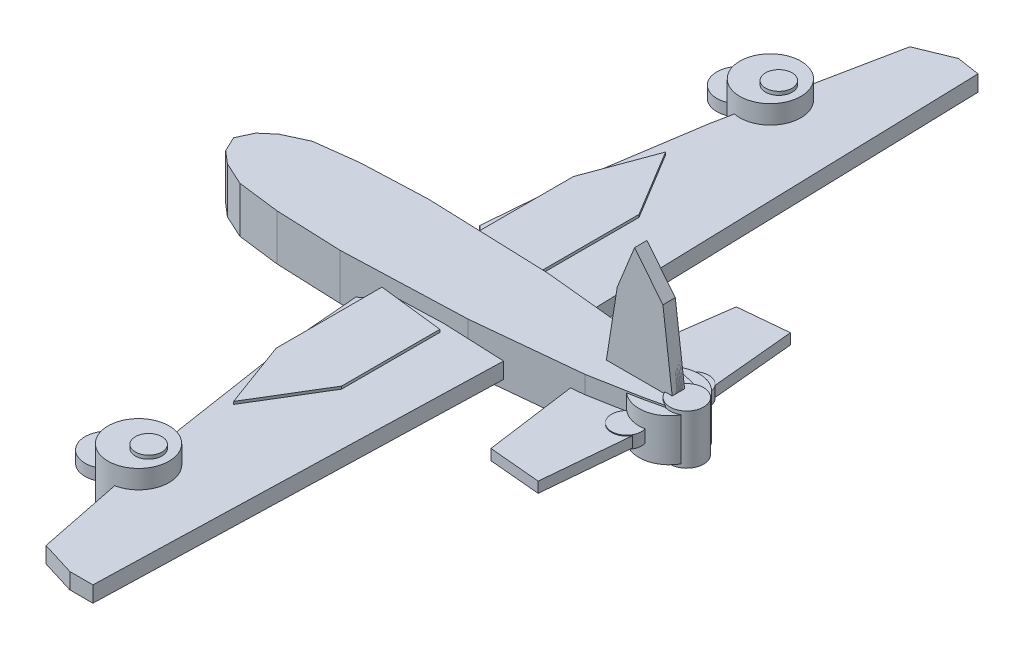
from build123d import *

# Parameters (mm, degrees)
BOSS_EXTRUDE1_DEPTH  = 130
BOSS_EXTRUDE2_DEPTH  = 57.5
SKETCH3_R            = 125
BOSS_EXTRUDE3_DEPTH  = 72.5
BOSS_EXTRUDE4_DEPTH  = 45
BOSS_EXTRUDE5_DEPTH  = 45
BOSS_EXTRUDE6_DEPTH  = 60
BOSS_EXTRUDE7_DEPTH  = 22.5
BOSS_EXTRUDE8_DEPTH  = 60
BOSS_EXTRUDE9_DEPTH  = 22.5
BOSS_EXTRUDE10_DEPTH = 30
BOSS_EXTRUDE11_DEPTH = 30
BOSS_EXTRUDE12_DEPTH = 35
BOSS_EXTRUDE13_DEPTH = 27.5
SKETCH14_R           = 172.485593128
BOSS_EXTRUDE14_DEPTH = 150
SKETCH15_R           = 172.485593128
BOSS_EXTRUDE15_DEPTH = 150
SKETCH16_R           = 170
BOSS_EXTRUDE16_DEPTH = 120
SKETCH17_R           = 75
BOSS_EXTRUDE17_DEPTH = 170
SKETCH18_R           = 75
BOSS_EXTRUDE18_DEPTH = 170
SKETCH19_R           = 95
BOSS_EXTRUDE19_DEPTH = 140
SKETCH20_R           = 129.971186256
BOSS_EXTRUDE20_DEPTH = 32.5
SKETCH21_R           = 85
BOSS_EXTRUDE21_DEPTH = 35
SKETCH22_R           = 129.971186256
BOSS_EXTRUDE22_DEPTH = 32.5
SKETCH23_R           = 85
BOSS_EXTRUDE23_DEPTH = 35
SKETCH24_R           = 125
BOSS_EXTRUDE24_DEPTH = 45
SKETCH25_R           = 75
BOSS_EXTRUDE25_DEPTH = 55


with BuildPart() as part:
    # Sketch1 → Boss-Extrude1 (new, symmetric)
    with BuildSketch(Plane(origin=(0, 0, 0), x_dir=(1, 0, 0), z_dir=(0, 1, 0))):
        Polygon((-1300, 0), (-1260, 85), (-1190, 145), (-1060, 205), (-820, 235), (-450, 250), (250, 225), (850, 165), (1120, 115), (1250, 85), (1300, 0), (1250, -85), (1120, -115), (850, -165), (250, -225), (-450, -250), (-820, -235), (-1060, -205), (-1190, -145), (-1260, -85), align=None)
    extrude(amount=BOSS_EXTRUDE1_DEPTH, both=True)


with BuildPart() as body_2:
    # Sketch2 → Boss-Extrude2 (new, symmetric)
    with BuildSketch(Plane(origin=(0, 0, 0), x_dir=(1, 0, 0), z_dir=(0, 1, 0))):
        Polygon((400, 25), (400, 70.922011884), (362.961005942, 107.961005942), (330.489239933, 140.432771951), (280, 140.432771951), (-560, 140.432771951), (-605.922011884, 140.432771951), (-638.393777893, 107.961005942), (-675.432771951, 70.922011884), (-675.432771951, 25), (-675.432771951, -25), (-675.432771951, -70.922011884), (-638.393777893, -107.961005942), (-605.922011884, -140.432771951), (-560, -140.432771951), (280, -140.432771951), (330.489239933, -140.432771951), (362.961005942, -107.961005942), (400, -70.922011884), (400, -25), align=None)
    extrude(amount=BOSS_EXTRUDE2_DEPTH, both=True)


with BuildPart() as body_3:
    # Sketch3 → Boss-Extrude3 (new, symmetric)
    with BuildSketch(Plane(origin=(0, 0, 0), x_dir=(1, 0, 0), z_dir=(0, 1, 0))):
        with Locations(Location((-1080, 0, 0), (0, 0, 270))):
            Circle(SKETCH3_R)
    extrude(amount=BOSS_EXTRUDE3_DEPTH, both=True)


with BuildPart() as body_4:
    # Sketch4 → Boss-Extrude4 (new, symmetric)
    with BuildSketch(Plane(origin=(0, 0, 0), x_dir=(1, 0, 0), z_dir=(0, 1, 0))):
        Polygon((-110, 220), (470, 245), (405, 2500), (275, 2520), (80, 2440), (-110, 1500), (-230, 720), (-260, 350), align=None)
    extrude(amount=BOSS_EXTRUDE4_DEPTH, both=True)


with BuildPart() as body_5:
    # Sketch5 → Boss-Extrude5 (new, symmetric)
    with BuildSketch(Plane(origin=(0, 0, 0), x_dir=(1, 0, 0), z_dir=(0, 1, 0))):
        Polygon((-110, -220), (470, -245), (405, -2500), (275, -2500), (80, -2440), (-110, -1500), (-230, -720), (-260, -350), align=None)
    extrude(amount=BOSS_EXTRUDE5_DEPTH, both=True)


with BuildPart() as body_6:
    # Sketch6 → Boss-Extrude6 (new, symmetric)
    with BuildSketch(Plane(origin=(0, 0, 0), x_dir=(1, 0, 0), z_dir=(0, 1, 0))):
        Polygon((-220.292993631, 241.796178344), (150, 285), (150, 840), (-80, 1220), (-220.292993631, 840), align=None)
    extrude(amount=BOSS_EXTRUDE6_DEPTH, both=True)


with BuildPart() as body_7:
    # Sketch7 → Boss-Extrude7 (new, symmetric)
    with BuildSketch(Plane(origin=(0, 0, 0), x_dir=(1, 0, 0), z_dir=(0, 1, 0))):
        Polygon((80, 1460), (407.295770497, 2420.35442354), (300.486303062, 2456.755866677), (-22.400496489, 1509.338288439), align=None)
    extrude(amount=BOSS_EXTRUDE7_DEPTH, both=True)


with BuildPart() as body_8:
    # Sketch8 → Boss-Extrude8 (new, symmetric)
    with BuildSketch(Plane(origin=(0, 0, 0), x_dir=(1, 0, 0), z_dir=(0, 1, 0))):
        Polygon((-220.292993631, -241.796178344), (150, -285), (150, -840), (-80, -1220), (-220.292993631, -840), align=None)
    extrude(amount=BOSS_EXTRUDE8_DEPTH, both=True)


with BuildPart() as body_9:
    # Sketch9 → Boss-Extrude9 (new, symmetric)
    with BuildSketch(Plane(origin=(0, 0, 0), x_dir=(1, 0, 0), z_dir=(0, 1, 0))):
        Polygon((80, -1460), (407.295770497, -2420.35442354), (300.486303062, -2456.755866677), (-22.400496489, -1509.338288439), align=None)
    extrude(amount=BOSS_EXTRUDE9_DEPTH, both=True)


with BuildPart() as body_10:
    # Sketch10 → Boss-Extrude10 (new, symmetric)
    with BuildSketch(Plane(origin=(0, 0, 0), x_dir=(1, 0, 0), z_dir=(0, 1, 0))):
        Polygon((760, 60), (1185, 100), (1126.764302373, 718.754287282), (846.948827, 692.418713129), align=None)
    extrude(amount=BOSS_EXTRUDE10_DEPTH, both=True)


with BuildPart() as body_11:
    # Sketch11 → Boss-Extrude11 (new, symmetric)
    with BuildSketch(Plane(origin=(0, 0, 0), x_dir=(1, 0, 0), z_dir=(0, 1, 0))):
        Polygon((760, -60), (1200, -60), (1140, -720), (846.967213115, -693.360655738), align=None)
    extrude(amount=BOSS_EXTRUDE11_DEPTH, both=True)


with BuildPart() as body_12:
    # Sketch12 → Boss-Extrude12 (new, symmetric)
    with BuildSketch(Plane.XY):
        Polygon((820, 0), (1230, 0), (1160, 560), (1000, 760), (901.951219512, 517.56097561), align=None)
    extrude(amount=BOSS_EXTRUDE12_DEPTH, both=True)


with BuildPart() as body_13:
    # Sketch13 → Boss-Extrude13 (new, symmetric)
    with BuildSketch(Plane.XY):
        Polygon((1030, 0), (1230, 0), (1181.230769231, 390.153846154), (1091.923076923, 459.615384615), (1043.423076923, 305.115384615), align=None)
    extrude(amount=BOSS_EXTRUDE13_DEPTH, both=True)


with BuildPart() as body_14:
    # Sketch14 → Boss-Extrude14 (new, symmetric)
    with BuildSketch(Plane(origin=(0, 0, 0), x_dir=(1, 0, 0), z_dir=(0, 1, 0))):
        with Locations(Location((-52.485593128, 1784.544960313, 0), (0, 0, 270))):
            Circle(SKETCH14_R)
    extrude(amount=BOSS_EXTRUDE14_DEPTH, both=True)


with BuildPart() as body_15:
    # Sketch15 → Boss-Extrude15 (new, symmetric)
    with BuildSketch(Plane(origin=(0, 0, 0), x_dir=(1, 0, 0), z_dir=(0, 1, 0))):
        with Locations(Location((-52.485593128, -1784.544960313, 0), (0, 0, 270))):
            Circle(SKETCH15_R)
    extrude(amount=BOSS_EXTRUDE15_DEPTH, both=True)


with BuildPart() as body_16:
    # Sketch16 → Boss-Extrude16 (new, symmetric)
    with BuildSketch(Plane(origin=(0, 0, 0), x_dir=(1, 0, 0), z_dir=(0, 1, 0))):
        with Locations(Location((1160, 0, 0), (0, 0, 270))):
            Circle(SKETCH16_R)
    extrude(amount=BOSS_EXTRUDE16_DEPTH, both=True)


with BuildPart() as body_17:
    # Sketch17 → Boss-Extrude17 (new, symmetric)
    with BuildSketch(Plane(origin=(0, 0, 0), x_dir=(1, 0, 0), z_dir=(0, 1, 0))):
        with Locations(Location((0, 1780, 0), (0, 0, 270))):
            Circle(SKETCH17_R)
    extrude(amount=BOSS_EXTRUDE17_DEPTH, both=True)


with BuildPart() as body_18:
    # Sketch18 → Boss-Extrude18 (new, symmetric)
    with BuildSketch(Plane(origin=(0, 0, 0), x_dir=(1, 0, 0), z_dir=(0, 1, 0))):
        with Locations(Location((0, -1780, 0), (0, 0, 270))):
            Circle(SKETCH18_R)
    extrude(amount=BOSS_EXTRUDE18_DEPTH, both=True)


with BuildPart() as body_19:
    # Sketch19 → Boss-Extrude19 (new, symmetric)
    with BuildSketch(Plane(origin=(0, 0, 0), x_dir=(1, 0, 0), z_dir=(0, 1, 0))):
        with Locations(Location((1260, 0, 0), (0, 0, 270))):
            Circle(SKETCH19_R)
    extrude(amount=BOSS_EXTRUDE19_DEPTH, both=True)


with BuildPart() as body_20:
    # Sketch20 → Boss-Extrude20 (new, symmetric)
    with BuildSketch(Plane(origin=(0, 0, 0), x_dir=(1, 0, 0), z_dir=(0, 1, 0))):
        with Locations(Location((-224.971186256, 1784.544960313, 0), (0, 0, 270))):
            Circle(SKETCH20_R)
    extrude(amount=BOSS_EXTRUDE20_DEPTH, both=True)


with BuildPart() as body_21:
    # Sketch21 → Boss-Extrude21 (new, symmetric)
    with BuildSketch(Plane(origin=(0, 0, 0), x_dir=(1, 0, 0), z_dir=(0, 1, 0))):
        with Locations(Location((1110, 190, 0), (0, 0, 270))):
            Circle(SKETCH21_R)
    extrude(amount=BOSS_EXTRUDE21_DEPTH, both=True)


with BuildPart() as body_22:
    # Sketch22 → Boss-Extrude22 (new, symmetric)
    with BuildSketch(Plane(origin=(0, 0, 0), x_dir=(1, 0, 0), z_dir=(0, 1, 0))):
        with Locations(Location((-224.971186256, -1784.544960313, 0), (0, 0, 270))):
            Circle(SKETCH22_R)
    extrude(amount=BOSS_EXTRUDE22_DEPTH, both=True)


with BuildPart() as body_23:
    # Sketch23 → Boss-Extrude23 (new, symmetric)
    with BuildSketch(Plane(origin=(0, 0, 0), x_dir=(1, 0, 0), z_dir=(0, 1, 0))):
        with Locations(Location((1110, -190, 0), (0, 0, 270))):
            Circle(SKETCH23_R)
    extrude(amount=BOSS_EXTRUDE23_DEPTH, both=True)


with BuildPart() as body_24:
    # Sketch24 → Boss-Extrude24 (new, symmetric)
    with BuildSketch(Plane(origin=(0, 0, 0), x_dir=(1, 0, 0), z_dir=(0, 1, 0))):
        with Locations(Location((-1080, 0, 0), (0, 0, 90))):
            Circle(SKETCH24_R)
    extrude(amount=BOSS_EXTRUDE24_DEPTH, both=True)


with BuildPart() as body_25:
    # Sketch25 → Boss-Extrude25 (new, symmetric)
    with BuildSketch(Plane.XY):
        with Locations((-1135, -45)):
            Circle(SKETCH25_R)
    extrude(amount=BOSS_EXTRUDE25_DEPTH, both=True)


solid = Compound([part.part, body_2.part, body_3.part, body_4.part, body_5.part, body_6.part, body_7.part, body_8.part, body_9.part, body_10.part, body_11.part, body_12.part, body_13.part, body_14.part, body_15.part, body_16.part, body_17.part, body_18.part, body_19.part, body_20.part, body_21.part, body_22.part, body_23.part, body_24.part, body_25.part])
